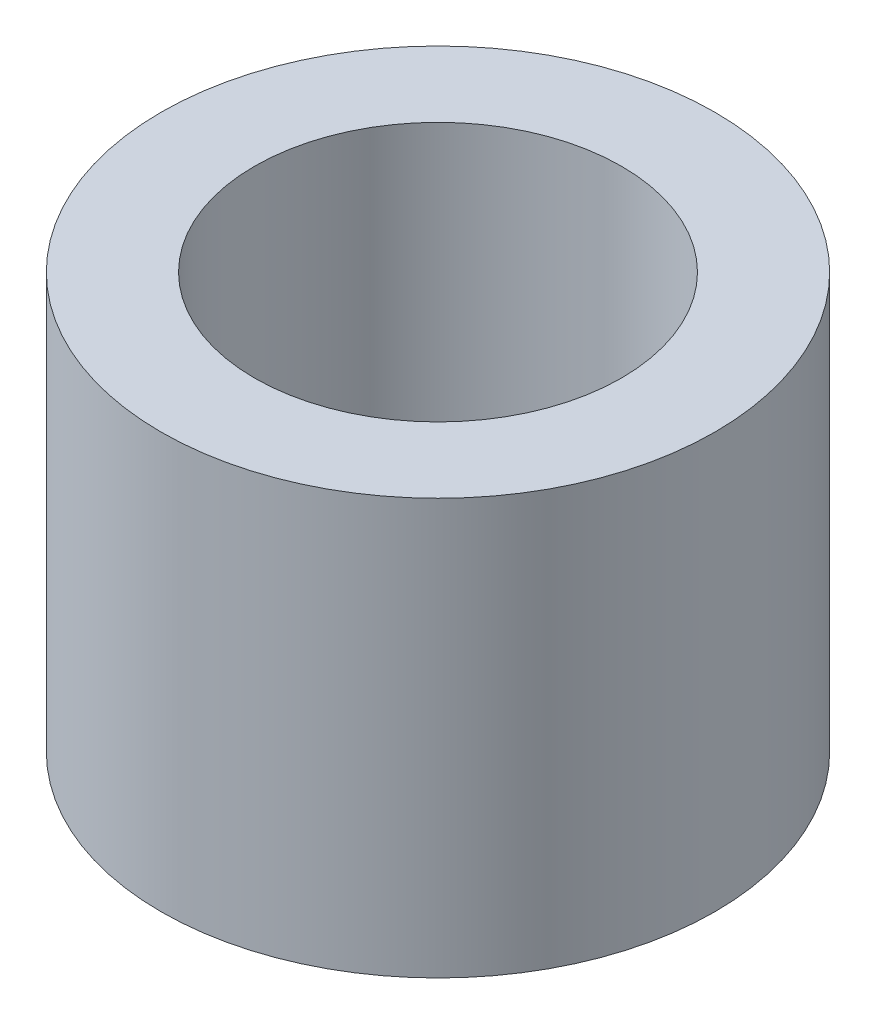
from build123d import *

# Parameters (mm, degrees)
SKETCH1_R           = 4
SKETCH1_R_2         = 2.65
BOSS_EXTRUDE1_DEPTH = 6


with BuildPart() as part:
    # Sketch1 → Boss-Extrude1 (new body)
    with BuildSketch(Plane(origin=(0, 0, 0), x_dir=(1, 0, 0), z_dir=(0, 1, 0))):
        with Locations(Location((0, 0, 0), (0, 0, 270))):
            Circle(SKETCH1_R)
        with Locations(Location((0, 0, 0), (0, 0, 270))):
            Circle(SKETCH1_R_2, mode=Mode.SUBTRACT)
    extrude(amount=BOSS_EXTRUDE1_DEPTH)


solid = part.part
